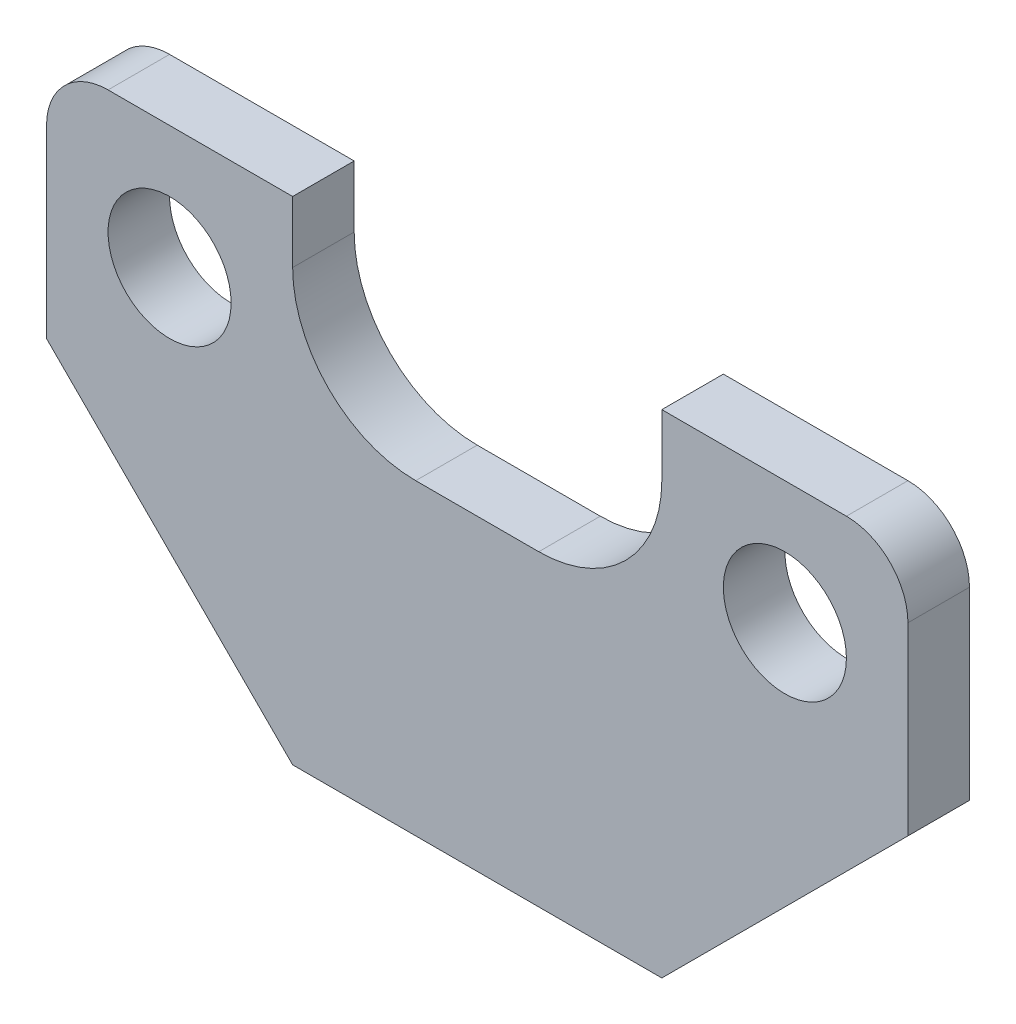
from build123d import *

# Parameters (mm, degrees)
IZIM1_R                     = 5
Y_KSEKLIK_EKSTR_ZYON1_DEPTH = 5


with BuildPart() as part:
    # Çizim1 → Yükseklik-Ekstrüzyon1 (new body)
    with BuildSketch(Plane.XY):
        with BuildLine():
            Line((-28.997620503, 16.872990354), (-13.997620503, 16.872990354))
            Line((-13.997620503, 16.872990354), (-13.997620503, 11.872990354))
            ThreePointArc((-13.997620503, 11.872990354), (-11.068688315, 4.801922542), (-3.997620503, 1.872990354))
            Line((-3.997620503, 1.872990354), (6.002379497, 1.872990354))
            ThreePointArc((6.002379497, 1.872990354), (13.073447309, 4.801922542), (16.002379497, 11.872990354))
            Line((16.002379497, 11.872990354), (16.002379497, 16.872990354))
            Line((16.002379497, 16.872990354), (31.002379497, 16.872990354))
            ThreePointArc((31.002379497, 16.872990354), (34.537913403, 15.40852426), (36.002379497, 11.872990354))
            Line((36.002379497, 11.872990354), (36.002379497, -3.127009646))
            Line((36.002379497, -3.127009646), (16.002379497, -23.127009646))
            Line((16.002379497, -23.127009646), (-13.997620503, -23.127009646))
            Line((-13.997620503, -23.127009646), (-33.997620503, -3.127009646))
            Line((-33.997620503, -3.127009646), (-33.997620503, 11.872990354))
            ThreePointArc((-33.997620503, 11.872990354), (-32.533154409, 15.40852426), (-28.997620503, 16.872990354))
        make_face()
        with Locations((-23.997620503, 6.872990354)):
            Circle(IZIM1_R, mode=Mode.SUBTRACT)
        with Locations((26.002379497, 6.872990354)):
            Circle(IZIM1_R, mode=Mode.SUBTRACT)
    extrude(amount=Y_KSEKLIK_EKSTR_ZYON1_DEPTH)


solid = part.part
